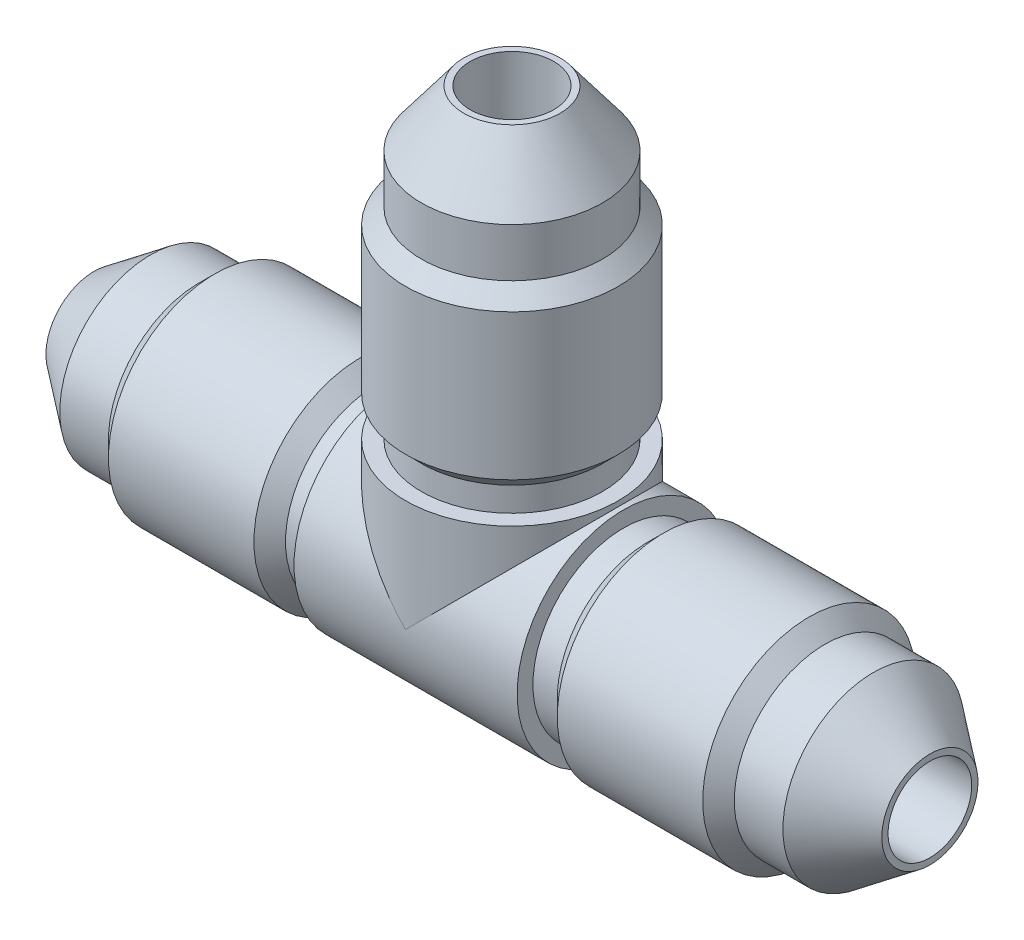
from build123d import *

# Parameters (mm, degrees)
SKETCH2_R           = 5.55625
EXTRUDE1_DEPTH      = 16.002
SKETCH15_R          = 5.55625
BOSS_EXTRUDE1_DEPTH = 5.826125
SKETCH16_R          = 2.1844
CUT_EXTRUDE1_DEPTH  = 24.199372171
CIRPATTERN1_COUNT   = 3
CIRPATTERN1_ANGLE   = 180
SKETCH17_R          = 2.1844
CUT_EXTRUDE2_DEPTH  = 50.124404517
CUT_EXTRUDE3_REACH  = 37.458
SKETCH18_R          = 2.1844


with BuildPart() as part:
    # Sketch2 → Extrude1 (new body)
    with BuildSketch(Plane(origin=(-21.828125, 0, 0), x_dir=(0, 0, -1), z_dir=(1, 0, 0))):
        Circle(SKETCH2_R)
    extrude(amount=EXTRUDE1_DEPTH)

    # Sketch5 → Cut-Revolve1 (revolve, cut)
    with BuildSketch(Plane.XY, mode=Mode.PRIVATE) as cut_revolve1_sk:
        Polygon((-18.883013362, 4.731360803), (-16.343013362, 4.731360803), (-15.518124165, 5.55625), (-21.828125, 5.55625), (-21.828125, 2.51206), align=None)
        Polygon((-5.826125, 4.731360803), (-7.096125, 4.731360803), (-7.921014197, 5.55625), (-5.826125, 5.55625), align=None)
    revolve(cut_revolve1_sk.sketch.rotate(Axis((0, 0, 0), (-1, 0, 0)), 90), axis=Axis((0, 0, 0), (-1, 0, 0)), mode=Mode.SUBTRACT)

    # Sketch15 → Boss-Extrude1 (add)
    with BuildSketch(Plane(origin=(-5.826125, 0, 0), x_dir=(0, 0, -1), z_dir=(1, 0, 0))):
        Circle(SKETCH15_R)
    extrude(amount=BOSS_EXTRUDE1_DEPTH)

    # Sketch16 → Cut-Extrude1 (cut, through all)
    with BuildSketch(Plane(origin=(0, 0, 0), x_dir=(0, 0, -1), z_dir=(1, 0, 0))):
        Circle(SKETCH16_R)
    extrude(amount=-CUT_EXTRUDE1_DEPTH, mode=Mode.SUBTRACT)


with BuildPart() as cirpattern1_1:
    # CirPattern1: pattern copy
    add(part.part.rotate(Axis((0, 0, 0), (0, 0, -1)), 1 * CIRPATTERN1_ANGLE / (CIRPATTERN1_COUNT - 1)))

    # Sketch17 → Cut-Extrude2 (cut, through all)
    with BuildSketch(Plane.ZY.offset(21.828125)):
        with Locations(Location((0, 0, 0), (0, 0, 180))):
            Circle(SKETCH17_R)
    extrude(amount=-CUT_EXTRUDE2_DEPTH, mode=Mode.SUBTRACT)


with BuildPart() as cirpattern1_2:
    # CirPattern1: pattern copy
    add(part.part.rotate(Axis((0, 0, 0), (0, 0, -1)), 2 * CIRPATTERN1_ANGLE / (CIRPATTERN1_COUNT - 1)))


with BuildPart() as cirpattern1_1_1:
    add(cirpattern1_1.part)

    # Combine1: union part, CirPattern1_2
    add(part.part)
    add(cirpattern1_2.part)

    # Sketch18 → Cut-Extrude3 (cut, up to next)
    with BuildSketch(Plane(origin=(0, 21.828125, 0), x_dir=(1, 0, 0), z_dir=(0, 1, 0)), mode=Mode.PRIVATE) as cut_extrude3_sk1:
        with Locations(Location((0, 0, 0), (0, 0, 90))):
            Circle(SKETCH18_R)
    cut_extrude3_tool1 = extrude(cut_extrude3_sk1.sketch, amount=-CUT_EXTRUDE3_REACH, mode=Mode.PRIVATE) & cirpattern1_1_1.part
    add(cut_extrude3_tool1.solids().sort_by_distance((0, 21.828125, 0))[0], mode=Mode.SUBTRACT)


solid = cirpattern1_1_1.part
